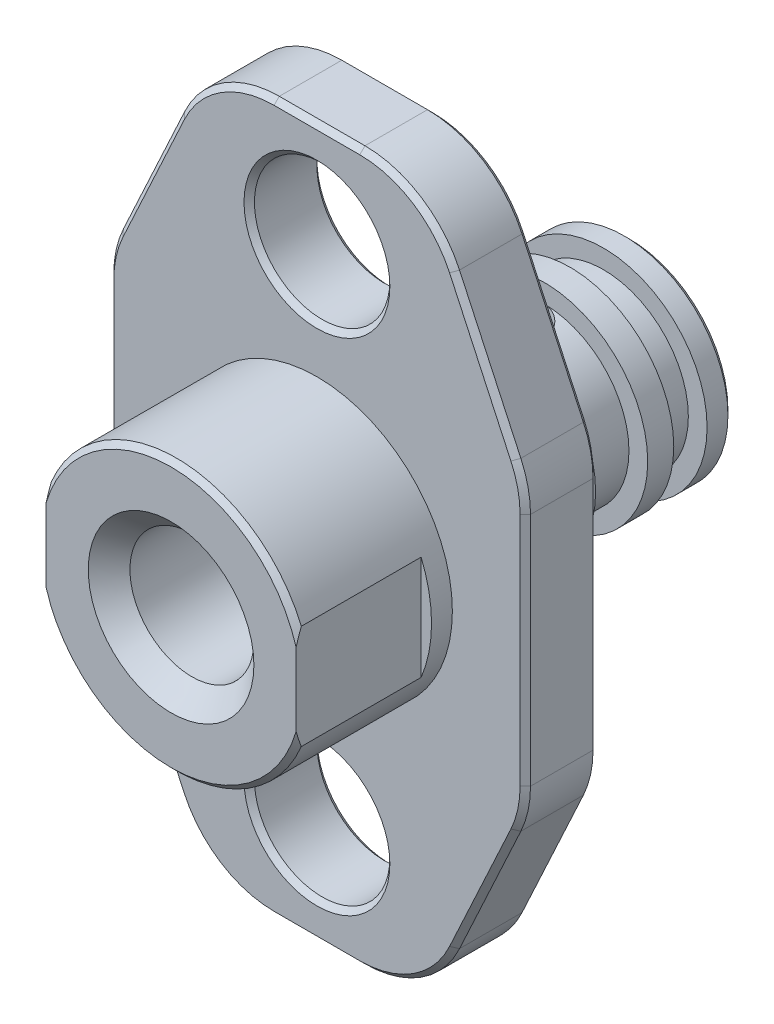
from build123d import *

# Parameters (mm, degrees)
SKETCH3_OUTSIDE_W  = 93.666
SKETCH3_OUTSIDE_H  = 93.666
SKETCH3_OUTSIDE_R  = 6.5
CUT_EXTRUDE1_DEPTH = 21
SKETCH4_W          = 2.5
SKETCH4_H          = 24.819260196
SKETCH7_W          = 2.358889098
SKETCH7_H          = 15
CUT_EXTRUDE2_DEPTH = 12
CIRPATTERN1_COUNT  = 2
CIRPATTERN1_ANGLE  = 180
CHAMFER1_SIZE      = 0.5


with BuildPart() as part:
    # Sketch1 → Revolve1 (revolve)
    with BuildSketch(Plane(origin=(0, 0, 0), x_dir=(0, 0, -1), z_dir=(1, 0, 0)), mode=Mode.PRIVATE) as revolve1_sk:
        Polygon((14, 13), (0.5, 13), (0, 12.5), (0, 7.95), (2, 5.95), (19, 5.95), (20.171678207, 4), (38, 4), (40.403442476, 0), (44, 0), (44, 9.45), (43.5, 9.95), (41.5, 9.95), (41.5, 8.15), (38.3, 8.15), (38.3, 9.95), (35.8, 9.95), (35.8, 8.15), (30.8, 8.15), (30.8, 9.95), (28.3, 9.95), (28.3, 8.15), (25.1, 8.15), (25.1, 9.95), (21, 9.95), (21, 35), (14, 35), align=None)
    revolve(revolve1_sk.sketch.rotate(Axis((0, 0, 0), (0, 0, -1)), 90), axis=Axis((0, 0, 0), (0, 0, -1)))

    # Sketch3 outside → Cut-Extrude1 (cut)
    # profile 1 of 3: a face of its own
    with BuildSketch(Plane.XY):
        Rectangle(SKETCH3_OUTSIDE_W, SKETCH3_OUTSIDE_H)
        with BuildLine():
            Line((-20, 11.295529415), (-20, -11.295529415))
            ThreePointArc((-20, -11.295529415), (-19.765527652, -13.448311261), (-19.073106065, -15.500139543))
            Line((-19.073106065, -15.500139543), (-13.185668477, -28.204610128))
            ThreePointArc((-13.185668477, -28.204610128), (-9.495586596, -32.427517466), (-4.112562412, -34))
            Line((-4.112562412, -34), (4.112562412, -34))
            ThreePointArc((4.112562412, -34), (9.495586596, -32.427517466), (13.185668477, -28.204610128))
            Line((13.185668477, -28.204610128), (19.073106065, -15.500139543))
            ThreePointArc((19.073106065, -15.500139543), (19.765527652, -13.448311261), (20, -11.295529415))
            Line((20, -11.295529415), (20, 11.295529415))
            ThreePointArc((20, 11.295529415), (19.765527652, 13.448311261), (19.073106065, 15.500139543))
            Line((19.073106065, 15.500139543), (13.185668477, 28.204610128))
            ThreePointArc((13.185668477, 28.204610128), (9.495586596, 32.427517466), (4.112562412, 34))
            Line((4.112562412, 34), (-4.112562412, 34))
            ThreePointArc((-4.112562412, 34), (-9.495586596, 32.427517466), (-13.185668477, 28.204610128))
            Line((-13.185668477, 28.204610128), (-19.073106065, 15.500139543))
            ThreePointArc((-19.073106065, 15.500139543), (-19.765527652, 13.448311261), (-20, 11.295529415))
        make_face(mode=Mode.SUBTRACT)
    # profile 2 of 3: a face of its own
    with BuildSketch(Plane.XY):
        with Locations((0, 24)):
            Circle(SKETCH3_OUTSIDE_R)
    # profile 3 of 3: a face of its own
    with BuildSketch(Plane.XY):
        with Locations((0, -24)):
            Circle(SKETCH3_OUTSIDE_R)
    extrude(amount=-CUT_EXTRUDE1_DEPTH, mode=Mode.SUBTRACT)

    # Sketch4 → Cut-Revolve1 (revolve, cut)
    with BuildSketch(Plane(origin=(0, 0, 0), x_dir=(0, 0, -1), z_dir=(1, 0, 0)), mode=Mode.PRIVATE) as cut_revolve1_sk:
        with Locations((34.55, 0)):
            Rectangle(SKETCH4_W, SKETCH4_H)
    revolve(cut_revolve1_sk.sketch.rotate(Axis((0, 12.409630098, -33.3), (0, -1, 0)), 180), axis=Axis((0, 12.409630098, -33.3), (0, -1, 0)), mode=Mode.SUBTRACT)

    # Sketch7 → Cut-Extrude2 (cut)
    with BuildSketch(Plane.XY):
        with Locations((-13.179444549, -0.815585695)):
            Rectangle(SKETCH7_W, SKETCH7_H)
    cut_extrude2 = extrude(amount=-CUT_EXTRUDE2_DEPTH, mode=Mode.SUBTRACT)

    # CirPattern1: Cut-Extrude2 ×2 about axis
    cirpattern1_axis = Axis((0, 0, 0), (0, 0, 1))
    for i in range(1, CIRPATTERN1_COUNT):
        add(cut_extrude2.rotate(cirpattern1_axis, i * CIRPATTERN1_ANGLE / (CIRPATTERN1_COUNT - 1)), mode=Mode.SUBTRACT)

    # Chamfer1
    chamfer1_edges = [part.edges().sort_by_distance(p)[0] for p in [
        (-6.5, 24, -21),
        (-6.5, 24, -14),
        (-6.5, -24, -21),
        (-6.5, -24, -14),
        (0, 34, -21),
        (-9.495586596, 32.427517466, -21),
        (-16.129387271, 21.852374836, -21),
        (-19.765527652, 13.448311261, -21),
        (-20, 0, -21),
        (-19.765527652, -13.448311261, -21),
        (-16.129387271, -21.852374836, -21),
        (-9.495586596, -32.427517466, -21),
        (0, -34, -21),
        (9.495586596, -32.427517466, -21),
        (16.129387271, -21.852374836, -21),
        (19.765527652, -13.448311261, -21),
        (20, 0, -21),
        (19.765527652, 13.448311261, -21),
        (16.129387271, 21.852374836, -21),
        (9.495586596, 32.427517466, -21),
        (-9.495586596, 32.427517466, -14),
        (0, 34, -14),
        (9.495586596, 32.427517466, -14),
        (16.129387271, 21.852374836, -14),
        (19.765527652, 13.448311261, -14),
        (20, 0, -14),
        (19.765527652, -13.448311261, -14),
        (16.129387271, -21.852374836, -14),
        (9.495586596, -32.427517466, -14),
        (0, -34, -14),
        (-9.495586596, -32.427517466, -14),
        (-16.129387271, -21.852374836, -14),
        (-19.765527652, -13.448311261, -14),
        (-20, 0, -14),
        (-19.765527652, 13.448311261, -14),
        (-16.129387271, 21.852374836, -14),
    ]]
    chamfer(chamfer1_edges, length=CHAMFER1_SIZE)


solid = part.part
